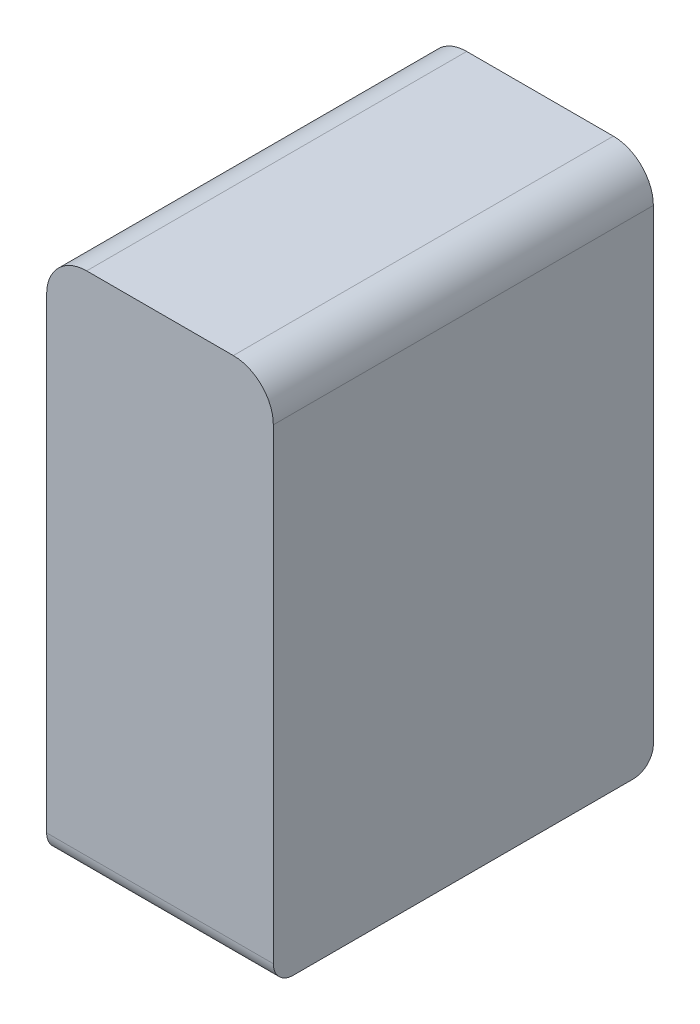
from build123d import *

# Parameters (mm, degrees)
SKETCH1_W           = 34
SKETCH1_H           = 79
BOSS_EXTRUDE1_DEPTH = 57
FILLET1_R           = 6
FILLET2_R           = 3


with BuildPart() as part:
    # Sketch1 → Boss-Extrude1 (new body)
    with BuildSketch(Plane.XY):
        Rectangle(SKETCH1_W, SKETCH1_H)
    extrude(amount=BOSS_EXTRUDE1_DEPTH)

    # Fillet1
    fillet1_edges = [part.edges().sort_by_distance(p)[0] for p in [
        (-17, 39.5, 28.5),
        (17, 39.5, 28.5),
    ]]
    fillet(fillet1_edges, radius=FILLET1_R)

    # Fillet2
    fillet2_edges = [part.edges().sort_by_distance(p)[0] for p in [
        (0, -39.5, 57),
        (0, -39.5, 0),
    ]]
    fillet(fillet2_edges, radius=FILLET2_R)


solid = part.part
